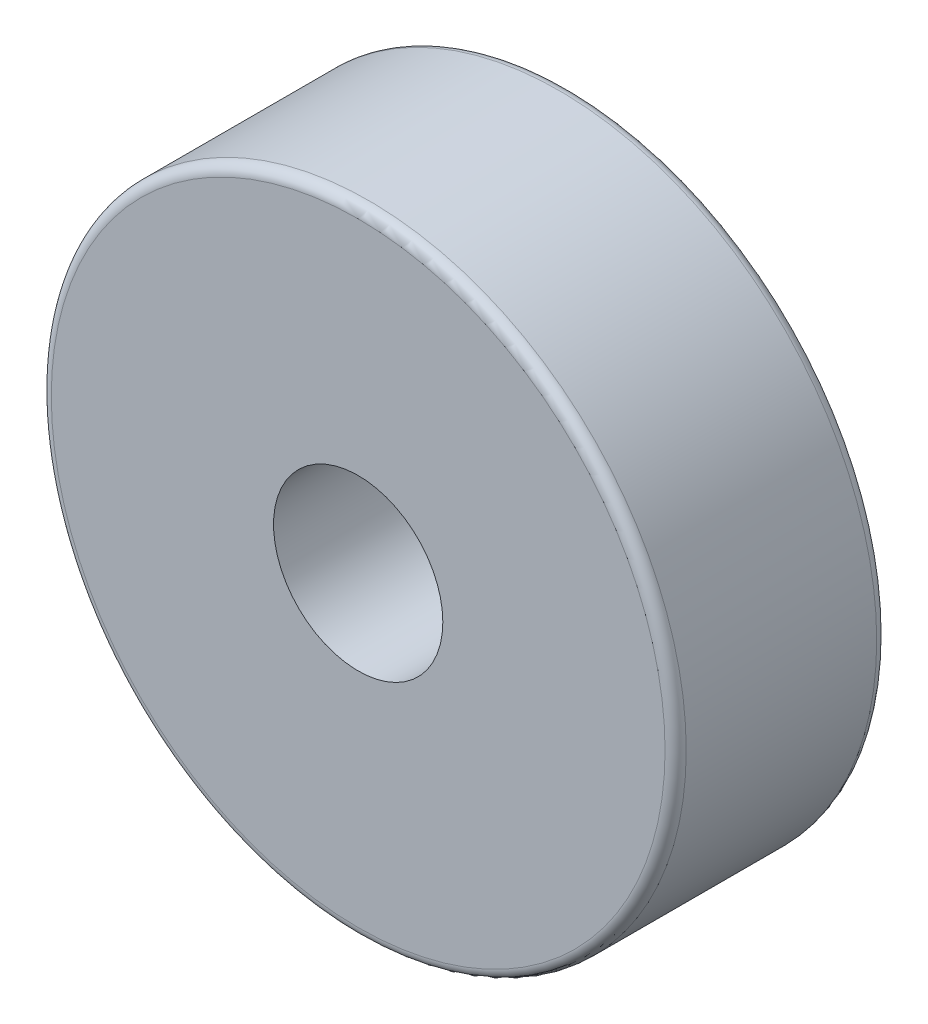
from build123d import *

# Parameters (mm, degrees)
SKETCH_1_R      = 15
SKETCH_1_R_2    = 4
EXTRUDE_1_DEPTH = 10
FILLET_1_R      = 0.5


with BuildPart() as part:
    # 草图1 → 凸台-拉伸1 (new body)
    with BuildSketch(Plane.XY):
        Circle(SKETCH_1_R)
        Circle(SKETCH_1_R_2, mode=Mode.SUBTRACT)
    extrude(amount=EXTRUDE_1_DEPTH)

    # 圆角1
    fillet_1_edges = [part.edges().sort_by_distance(p)[0] for p in [
        (-15, 0, 0),
        (-15, 0, 10),
    ]]
    fillet(fillet_1_edges, radius=FILLET_1_R)


solid = part.part
